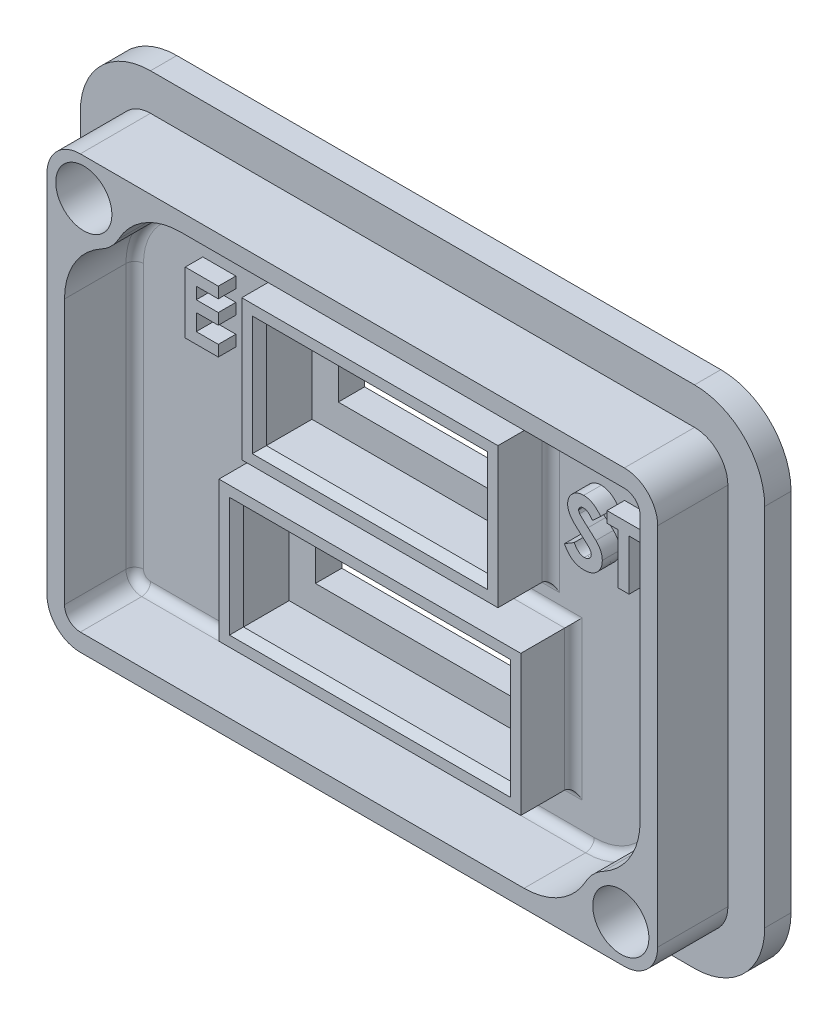
from build123d import *

# Parameters (mm, degrees)
AUFSATZ_LINEAR_AUSTRAGEN1_DEPTH = 1.5
SKIZZE2_R                       = 1.6
AUFSATZ_LINEAR_AUSTRAGEN2_DEPTH = 4
SKIZZE3_W                       = 17.2
SKIZZE3_H                       = 8
SKIZZE3_W_2                     = 15.2
SKIZZE3_H_2                     = 6
SKIZZE3_W_3                     = 14.6
SKIZZE3_W_4                     = 12.6
AUFSATZ_LINEAR_AUSTRAGEN3_DEPTH = 3
SKIZZE4_W                       = 9.6
SKIZZE4_H                       = 2
SKIZZE4_W_2                     = 12.2
SCHNITT_LINEAR_AUSTRAGEN1_DEPTH = 25.568475736
VERRUNDUNG1_R                   = 0.5
FASE1_SIZE                      = 0.4
AUFSATZ_LINEAR_AUSTRAGEN4_DEPTH = 1
SCHNITT_LINEAR_START            = -0.6
SKIZZE6_R                       = 1.6
SCHNITT_LINEAR_AUSTRAGEN2_DEPTH = 0.6


with BuildPart() as part:
    # Skizze1 → Aufsatz-Linear austragen1 (new body)
    with BuildSketch(Plane.XY):
        with BuildLine():
            Line((15.5, -14.4), (-15.5, -14.4))
            ThreePointArc((-15.5, -14.4), (-18.328427125, -13.228427125), (-19.5, -10.4))
            Line((-19.5, -10.4), (-19.5, 10.4))
            ThreePointArc((-19.5, 10.4), (-18.328427125, 13.228427125), (-15.5, 14.4))
            Line((-15.5, 14.4), (15.5, 14.4))
            ThreePointArc((15.5, 14.4), (18.328427125, 13.228427125), (19.5, 10.4))
            Line((19.5, 10.4), (19.5, -10.4))
            ThreePointArc((19.5, -10.4), (18.328427125, -13.228427125), (15.5, -14.4))
        make_face()
    extrude(amount=AUFSATZ_LINEAR_AUSTRAGEN1_DEPTH)

    # Skizze2 → Aufsatz-Linear austragen2 (add)
    with BuildSketch(Plane.XY.offset(1.5)):
        with BuildLine():
            Line((-15.5, -12.3), (15.5, -12.3))
            ThreePointArc((15.5, -12.3), (16.843502884, -11.743502884), (17.4, -10.4))
            Line((17.4, -10.4), (17.4, 10.4))
            ThreePointArc((17.4, 10.4), (16.843502884, 11.743502884), (15.5, 12.3))
            Line((15.5, 12.3), (-15.5, 12.3))
            ThreePointArc((-15.5, 12.3), (-16.843502884, 11.743502884), (-17.4, 10.4))
            Line((-17.4, 10.4), (-17.4, -10.4))
            ThreePointArc((-17.4, -10.4), (-16.843502884, -11.743502884), (-15.5, -12.3))
        make_face()
        with Locations((-15.3, 10.2)):
            Circle(SKIZZE2_R, mode=Mode.SUBTRACT)
        with Locations((15.3, -10.2)):
            Circle(SKIZZE2_R, mode=Mode.SUBTRACT)
        with BuildLine():
            Line((15.5, 11.3), (-9.786857257, 11.3))
            ThreePointArc((-9.786857257, 11.3), (-11.832490505, 10.737351395), (-13.302637407, 9.207692308))
            ThreePointArc((-13.302637407, 9.207692308), (-13.732233047, 8.632233047), (-14.307692308, 8.202637407))
            ThreePointArc((-14.307692308, 8.202637407), (-15.837351395, 6.732490505), (-16.4, 4.686857257))
            Line((-16.4, 4.686857257), (-16.4, -10.4))
            ThreePointArc((-16.4, -10.4), (-16.136396103, -11.036396103), (-15.5, -11.3))
            Line((-15.5, -11.3), (9.786857257, -11.3))
            ThreePointArc((9.786857257, -11.3), (11.832490505, -10.737351395), (13.302637407, -9.207692308))
            ThreePointArc((13.302637407, -9.207692308), (13.732233047, -8.632233047), (14.307692308, -8.202637407))
            ThreePointArc((14.307692308, -8.202637407), (15.837351395, -6.732490505), (16.4, -4.686857257))
            Line((16.4, -4.686857257), (16.4, 10.4))
            ThreePointArc((16.4, 10.4), (16.136396103, 11.036396103), (15.5, 11.3))
        make_face(mode=Mode.SUBTRACT)
    extrude(amount=AUFSATZ_LINEAR_AUSTRAGEN2_DEPTH)

    # Skizze3 → Aufsatz-Linear austragen3 (add)
    # profile 1 of 2: a face of its own
    with BuildSketch(Plane.XY.offset(1.5)):
        with Locations((0, -4.8)):
            Rectangle(SKIZZE3_W, SKIZZE3_H)
        with Locations((0, -4.8)):
            Rectangle(SKIZZE3_W_2, SKIZZE3_H_2, mode=Mode.SUBTRACT)
    # profile 2 of 2: a face of its own
    with BuildSketch(Plane.XY.offset(1.5)):
        with Locations((0, 4.8)):
            Rectangle(SKIZZE3_W_3, SKIZZE3_H)
        with Locations((0, 4.8)):
            Rectangle(SKIZZE3_W_4, SKIZZE3_H_2, mode=Mode.SUBTRACT)
    extrude(amount=AUFSATZ_LINEAR_AUSTRAGEN3_DEPTH)

    # Skizze4 → Schnitt-Linear austragen1 (cut, through all)
    with BuildSketch(Plane.XY.offset(1.5)):
        with Locations((0, 4.4)):
            Rectangle(SKIZZE4_W, SKIZZE4_H)
        with Locations((0, -5.2)):
            Rectangle(SKIZZE4_W_2, SKIZZE4_H)
    extrude(amount=-SCHNITT_LINEAR_AUSTRAGEN1_DEPTH, mode=Mode.SUBTRACT)

    # Verrundung1
    verrundung1_edges = [part.edges().sort_by_distance(p)[0] for p in [
        (7.3, 4.8, 1.5),
        (0, 8.8, 1.5),
        (-7.3, 4.8, 1.5),
        (0, 0.8, 1.5),
        (8.6, -4.8, 1.5),
        (0, -0.8, 1.5),
        (-8.6, -4.8, 1.5),
        (0, -8.8, 1.5),
        (16.136396103, 11.036396103, 1.5),
        (2.856571371, 11.3, 1.5),
        (-11.832490505, 10.737351395, 1.5),
        (-13.732233047, 8.632233047, 1.5),
        (-15.837351395, 6.732490505, 1.5),
        (-16.4, -2.856571371, 1.5),
        (-16.136396103, -11.036396103, 1.5),
        (-2.856571371, -11.3, 1.5),
        (11.832490505, -10.737351395, 1.5),
        (13.732233047, -8.632233047, 1.5),
        (15.837351395, -6.732490505, 1.5),
        (16.4, 2.856571371, 1.5),
    ]]
    fillet(verrundung1_edges, radius=VERRUNDUNG1_R)

    # Fase1
    fase1_edges = [part.edges().sort_by_distance(p)[0] for p in [
        (-6.3, 4.8, 4.5),
        (0, 1.8, 4.5),
        (6.3, 4.8, 4.5),
        (0, 7.8, 4.5),
        (-7.6, -4.8, 4.5),
        (0, -7.8, 4.5),
        (7.6, -4.8, 4.5),
        (0, -1.8, 4.5),
    ]]
    chamfer(fase1_edges, length=FASE1_SIZE)

    # Skizze5 → Aufsatz-Linear austragen4 (add)
    with BuildSketch(Plane.XY.offset(1.5)):
        Polygon((-12.52075545, 6.701829617), (-10.636140065, 6.701829617), (-10.636140065, 6.073624489), (-11.892550322, 6.073624489), (-11.892550322, 5.400547566), (-10.636140065, 5.400547566), (-10.636140065, 4.772342437), (-11.892550322, 4.772342437), (-11.892550322, 3.830034745), (-10.636140065, 3.830034745), (-10.636140065, 3.201829617), (-12.52075545, 3.201829617), align=None)
        Polygon((11.513326702, 6.701829617), (13.397942086, 6.701829617), (13.397942086, 6.073624489), (12.769736958, 6.073624489), (12.769736958, 3.201829617), (12.14153183, 3.201829617), (12.14153183, 6.073624489), (11.513326702, 6.073624489), align=None)
        with BuildLine():
            Line((11.154352343, 6.23418138), (10.68460074, 5.804393719))
            add(Edge.make_bspline(
                [(10.68460074, 5.804393719), (10.664478596, 5.832778096), (10.625846885, 5.887272141), (10.56322891, 5.960240951), (10.500893688, 6.022488777), (10.43826372, 6.073755575), (10.374783879, 6.113729861), (10.310564355, 6.142032098), (10.245969228, 6.160024098), (10.202571273, 6.162264535), (10.181195291, 6.163368078)],
                knots=[0, 0, 0, 0, 1.299362458, 2.494594718, 3.587462134, 4.587049575, 5.512617175, 6.380583204, 7.202344345, 8, 8, 8, 8], degree=3))
            add(Edge.make_bspline(
                [(10.181195291, 6.163368078), (10.161256389, 6.162668823), (10.122759607, 6.161318743), (10.067879587, 6.147899054), (10.019156325, 6.124738642), (9.97663737, 6.094454454), (9.942956085, 6.057969029), (9.916064191, 6.0197052), (9.900921795, 5.977470585), (9.898928758, 5.948462149), (9.897942086, 5.934101252)],
                knots=[0, 0, 0, 0, 1.185010067, 2.2879431, 3.333075148, 4.379039566, 5.372662701, 6.27520591, 7.14612461, 8, 8, 8, 8], degree=3))
            add(Edge.make_bspline(
                [(9.897942086, 5.934101252), (9.898560383, 5.919533264), (9.899805548, 5.890195362), (9.911832142, 5.847197012), (9.929959653, 5.805182619), (9.94728123, 5.779606458), (9.956135195, 5.766533143)],
                knots=[0, 0, 0, 0, 0.967525499, 1.948461899, 2.951351359, 4, 4, 4, 4], degree=3))
            add(Edge.make_bspline(
                [(9.956135195, 5.766533143), (9.964184408, 5.756371391), (9.982712632, 5.732980381), (10.018042161, 5.695932666), (10.06240863, 5.650545974), (10.117519354, 5.598381018), (10.181086534, 5.537561743), (10.256056593, 5.470478978), (10.340271564, 5.395055248), (10.400129615, 5.342532893), (10.431495772, 5.315010707)],
                knots=[0, 0, 0, 0, 0.473873513, 1.090794244, 1.870441696, 2.795289791, 3.865433203, 5.087734844, 6.473946851, 8, 8, 8, 8], degree=3))
            add(Edge.make_bspline(
                [(10.431495772, 5.315010707), (10.460937423, 5.289530443), (10.516811559, 5.241174197), (10.596309358, 5.172540269), (10.666174684, 5.110791998), (10.727425314, 5.056856093), (10.779132749, 5.010166643), (10.821514366, 4.970500472), (10.855087786, 4.938629808), (10.87417231, 4.919379908), (10.882317086, 4.911164553)],
                knots=[0, 0, 0, 0, 1.543621617, 2.929473131, 4.163658386, 5.240097082, 6.164993805, 6.925417477, 7.541396219, 8, 8, 8, 8], degree=3))
            add(Edge.make_bspline(
                [(10.882317086, 4.911164553), (10.913216671, 4.877724585), (10.972616524, 4.813441222), (11.049815392, 4.713822227), (11.113352559, 4.616573776), (11.162506115, 4.51986598), (11.199628858, 4.422303539), (11.225800884, 4.321493739), (11.241475484, 4.216383181), (11.243215731, 4.144658056), (11.244095932, 4.108380098)],
                knots=[0, 0, 0, 0, 1.206664779, 2.319633467, 3.337109185, 4.282041471, 5.190008762, 6.099243693, 7.03861361, 8, 8, 8, 8], degree=3))
            add(Edge.make_bspline(
                [(11.244095932, 4.108380098), (11.243469427, 4.073031676), (11.242240201, 4.003676758), (11.227184533, 3.902186165), (11.205716035, 3.805055264), (11.17252197, 3.713340974), (11.13206524, 3.625537835), (11.081346887, 3.54301354), (11.021785135, 3.464932909), (10.953518222, 3.392691729), (10.87800691, 3.327137865), (10.797013852, 3.268780267), (10.709747056, 3.220598637), (10.616952116, 3.180924501), (10.518678703, 3.150366951), (10.415043892, 3.127782074), (10.305889164, 3.114226986), (10.231247588, 3.112809963), (10.193114362, 3.112086027)],
                knots=[0, 0, 0, 0, 1.043214005, 2.046824704, 3.02475056, 3.976699089, 4.921714032, 5.875962561, 6.831408892, 7.817874052, 8.806269674, 9.781291748, 10.760897367, 11.74438705, 12.757449933, 13.795994037, 14.874007457, 16, 16, 16, 16], degree=3))
            add(Edge.make_bspline(
                [(10.193114362, 3.112086027), (10.163180104, 3.112617081), (10.103893106, 3.113668872), (10.016513035, 3.122255868), (9.932137698, 3.136114367), (9.850862137, 3.155977737), (9.772320192, 3.181147319), (9.696508636, 3.211891), (9.623950822, 3.248685295), (9.554097743, 3.290773567), (9.487288971, 3.339643594), (9.422679736, 3.394296246), (9.360911798, 3.455572104), (9.301688498, 3.523326253), (9.245388764, 3.597750557), (9.190169702, 3.677808519), (9.138485414, 3.764985907), (9.106557731, 3.82614155), (9.090249779, 3.857378495)],
                knots=[0, 0, 0, 0, 1.016823716, 2.013894106, 2.979844003, 3.91962641, 4.853723003, 5.779685073, 6.695824784, 7.614987388, 8.547259901, 9.504950863, 10.487499108, 11.500346958, 12.559593716, 13.656357062, 14.802919212, 16, 16, 16, 16], degree=3))
            Line((9.090249779, 3.857378495), (9.642733753, 4.189009104))
            add(Edge.make_bspline(
                [(9.642733753, 4.189009104), (9.663132564, 4.15355109), (9.702238827, 4.085575047), (9.768508046, 3.994240618), (9.836397478, 3.916027799), (9.907476666, 3.852319004), (9.980881312, 3.802262368), (10.05696598, 3.766488422), (10.135784124, 3.744344391), (10.189471463, 3.741640093), (10.216251381, 3.740291155)],
                knots=[0, 0, 0, 0, 1.283663364, 2.460892379, 3.537111102, 4.529833553, 5.449777664, 6.316464042, 7.160231139, 8, 8, 8, 8], degree=3))
            add(Edge.make_bspline(
                [(10.216251381, 3.740291155), (10.243490392, 3.741392771), (10.29633804, 3.743530066), (10.371771296, 3.763271613), (10.440931361, 3.79426729), (10.50071281, 3.838493847), (10.551331972, 3.889538016), (10.588691819, 3.946326988), (10.612161527, 4.007771285), (10.614642844, 4.050454535), (10.615890804, 4.071921764)],
                knots=[0, 0, 0, 0, 1.13588714, 2.203786484, 3.234766741, 4.283437687, 5.291419208, 6.222934724, 7.106237994, 8, 8, 8, 8], degree=3))
            add(Edge.make_bspline(
                [(10.615890804, 4.071921764), (10.614738364, 4.091893528), (10.612397292, 4.132464253), (10.595153676, 4.192786397), (10.568196645, 4.253081109), (10.536304576, 4.302536462), (10.503850403, 4.343944089), (10.472816893, 4.379821924), (10.435026287, 4.419460651), (10.390574406, 4.462910133), (10.340048575, 4.510552865), (10.283406232, 4.562384183), (10.219998763, 4.617947515), (10.175182239, 4.655796707), (10.151748176, 4.67558763)],
                knots=[0, 0, 0, 0, 0.916159276, 1.861089862, 2.860218735, 3.940849679, 4.552606315, 5.27541173, 6.11797699, 7.06649574, 8.129236253, 9.306560635, 10.591630461, 12, 12, 12, 12], degree=3))
            add(Edge.make_bspline(
                [(10.151748176, 4.67558763), (10.10719909, 4.713280429), (10.021695909, 4.785624319), (9.900869066, 4.892473967), (9.791993263, 4.992334754), (9.696008866, 5.086441177), (9.611692887, 5.173055308), (9.539616349, 5.252880662), (9.480571047, 5.32653298), (9.418438599, 5.413769223), (9.35940035, 5.520072579), (9.308374549, 5.647967839), (9.275271163, 5.775846872), (9.271562389, 5.861697811), (9.269736958, 5.903953014)],
                knots=[0, 0, 0, 0, 1.345494975, 2.582412109, 3.71882943, 4.751509156, 5.681369928, 6.505683931, 7.230279997, 7.856715994, 8.973648664, 10.023341002, 11.027102913, 12, 12, 12, 12], degree=3))
            add(Edge.make_bspline(
                [(9.269736958, 5.903953014), (9.270496153, 5.933918137), (9.271991847, 5.992952647), (9.285333675, 6.079754292), (9.305273544, 6.163510586), (9.334231959, 6.243915948), (9.371816484, 6.320869668), (9.417461431, 6.394748465), (9.471875578, 6.464872376), (9.533196648, 6.531194914), (9.600756767, 6.591806166), (9.67295334, 6.645301669), (9.749377728, 6.690484749), (9.829562405, 6.727967395), (9.914004243, 6.756657979), (10.002081161, 6.776995295), (10.093919491, 6.789091282), (10.15638594, 6.790735591), (10.188206509, 6.791573207)],
                knots=[0, 0, 0, 0, 1.010766082, 1.991317756, 2.957454644, 3.913069143, 4.869106762, 5.843196583, 6.838735724, 7.860187025, 8.887984031, 9.89767229, 10.887916223, 11.879572884, 12.879850636, 13.892031539, 14.926195476, 16, 16, 16, 16], degree=3))
            add(Edge.make_bspline(
                [(10.188206509, 6.791573207), (10.229444392, 6.790064637), (10.31159464, 6.787059406), (10.433056151, 6.763559481), (10.551694676, 6.726603373), (10.647295823, 6.682019895), (10.723363872, 6.638831859), (10.781662925, 6.599069756), (10.84098535, 6.553520129), (10.901809545, 6.502039441), (10.963005302, 6.443657726), (11.026312709, 6.379764809), (11.090869126, 6.309808504), (11.132820561, 6.259832044), (11.154352343, 6.23418138)],
                knots=[0, 0, 0, 0, 1.282922637, 2.555718331, 3.837320111, 5.142675274, 5.830281639, 6.55870424, 7.337177975, 8.157850921, 9.037902056, 9.96903443, 10.957596896, 12, 12, 12, 12], degree=3))
        make_face()
    extrude(amount=AUFSATZ_LINEAR_AUSTRAGEN4_DEPTH)

    # Skizze6 → Schnitt-Linear austragen2 (cut)
    with BuildSketch(Plane.XY.offset(1.5).offset(SCHNITT_LINEAR_START)):
        with Locations((15.3, -10.2)):
            Circle(SKIZZE6_R)
        with Locations((-15.3, 10.2)):
            Circle(SKIZZE6_R)
    extrude(amount=SCHNITT_LINEAR_AUSTRAGEN2_DEPTH, mode=Mode.SUBTRACT)


solid = part.part
